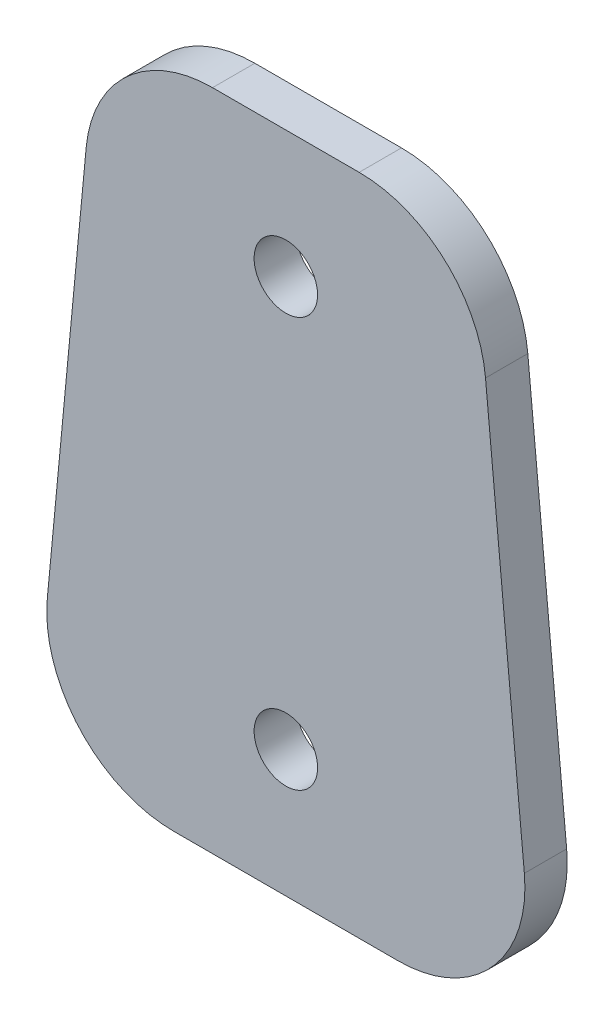
from build123d import *

# Parameters (mm, degrees)
SKETCH1_R           = 2.38125
BOSS_EXTRUDE1_DEPTH = 3.175


with BuildPart() as part:
    # Sketch1 → Boss-Extrude1 (new body)
    with BuildSketch(Plane.XY):
        with BuildLine():
            Line((41.710869071, 62.367198887), (38.796438037, 93.101198887))
            ThreePointArc((38.796438037, 93.101198887), (35.723374666, 99.247938348), (29.31397705, 101.727))
            Line((29.31397705, 101.727), (18.31102295, 101.727))
            ThreePointArc((18.31102295, 101.727), (11.901625334, 99.247938348), (8.828561963, 93.101198887))
            Line((8.828561963, 93.101198887), (5.914130929, 62.367198887))
            ThreePointArc((5.914130929, 62.367198887), (8.350653568, 55.058602384), (15.396591915, 51.943))
            Line((15.396591915, 51.943), (32.228408085, 51.943))
            ThreePointArc((32.228408085, 51.943), (39.274346432, 55.058602384), (41.710869071, 62.367198887))
        make_face()
        with Locations((23.8125, 61.468)):
            Circle(SKETCH1_R, mode=Mode.SUBTRACT)
        with Locations((23.8125, 92.202)):
            Circle(SKETCH1_R, mode=Mode.SUBTRACT)
    extrude(amount=BOSS_EXTRUDE1_DEPTH)


solid = part.part
